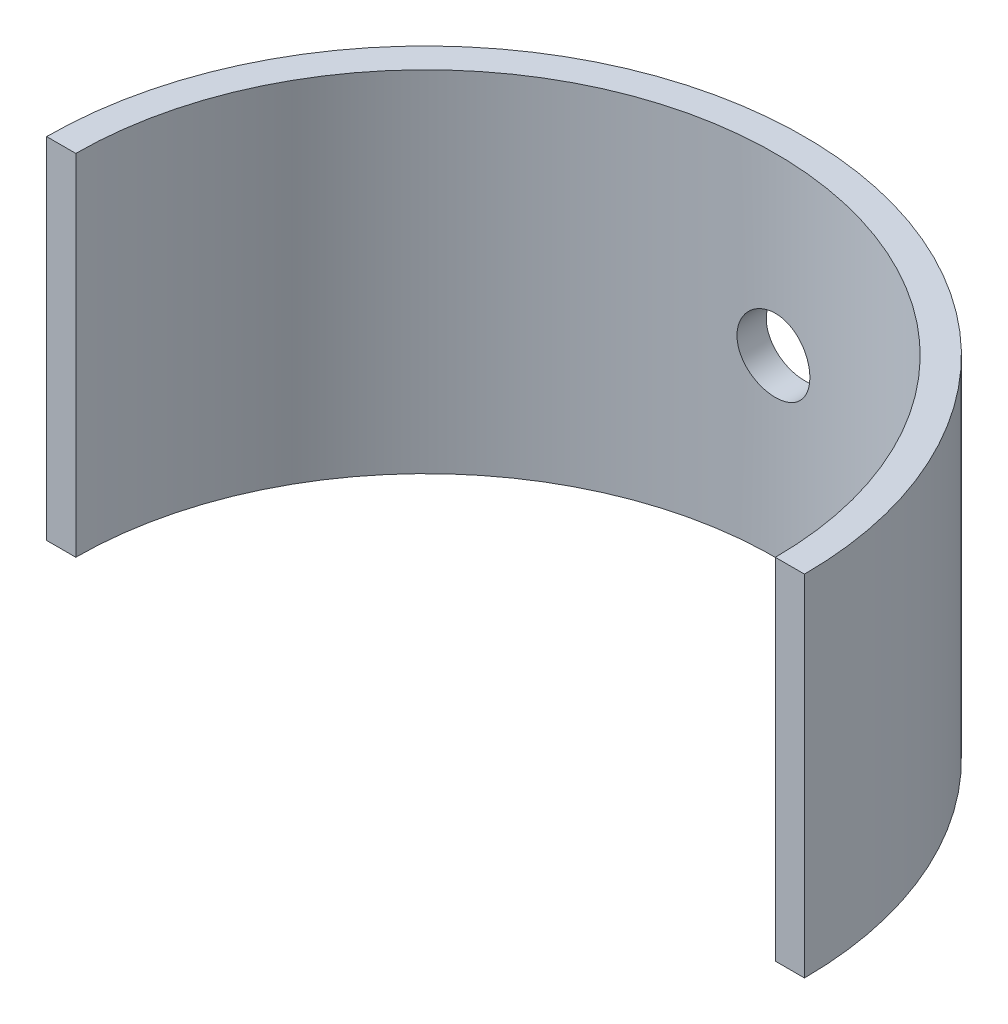
from build123d import *

# Parameters (mm, degrees)
EXTRUDE_1_DEPTH                 = 24
HOLE_WIZARD_5_0_5_1_D           = 5
HOLE_WIZARD_5_0_5_1_CSINK_D     = 5.05
HOLE_WIZARD_5_0_5_1_CSINK_ANGLE = 90


with BuildPart() as part:
    # 草图1 → 凸台-拉伸1 (new body)
    with BuildSketch(Plane(origin=(0, 0, 0), x_dir=(1, 0, 0), z_dir=(0, 1, 0))):
        with BuildLine():
            Line((-26, 0), (-24, 0))
            ThreePointArc((-24, 0), (0, 24), (24, 0))
            Line((24, 0), (26, 0))
            ThreePointArc((26, 0), (0, 26), (-26, 0))
        make_face()
    extrude(amount=EXTRUDE_1_DEPTH)

    # Ø5.0 (5) 直径孔1 (through all)
    with Locations(Plane.XY):
        with Locations((0, 12)):
            CounterSinkHole(HOLE_WIZARD_5_0_5_1_D / 2, HOLE_WIZARD_5_0_5_1_CSINK_D / 2, counter_sink_angle=HOLE_WIZARD_5_0_5_1_CSINK_ANGLE)


solid = part.part
